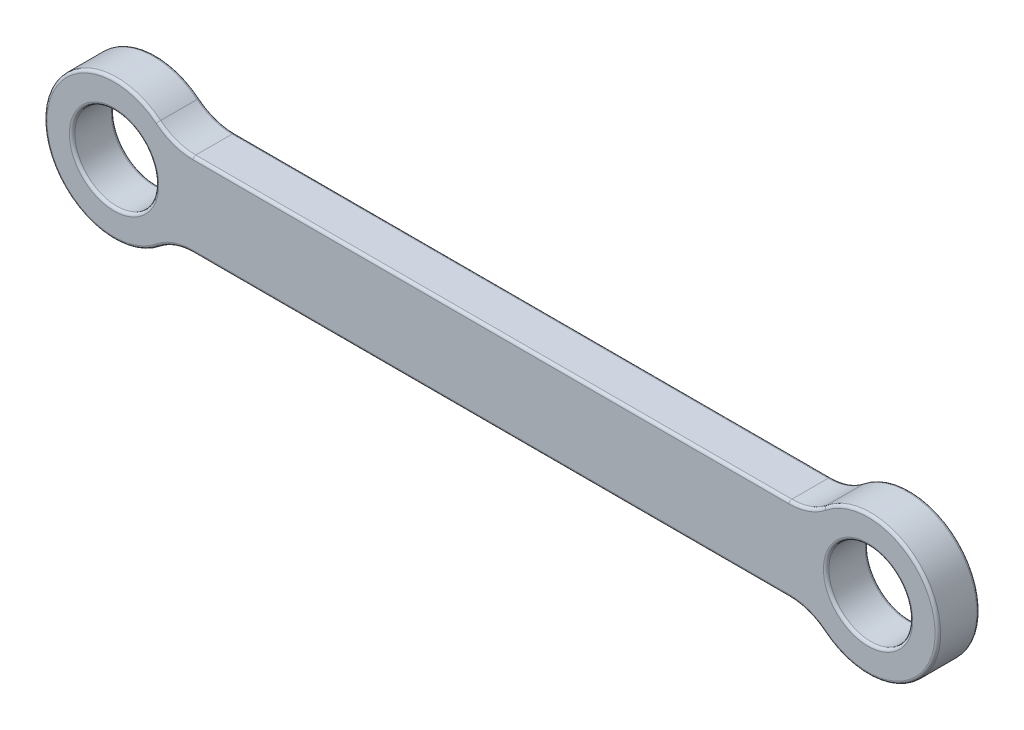
from build123d import *

# Parameters (mm, degrees)
SKETCH2_R           = 5
SKETCH2_R_2         = 3
BOSS_EXTRUDE1_DEPTH = 3
FILLET1_R           = 4
FILLET2_R           = 0.2


with BuildPart() as part:
    # Sketch2 → Boss-Extrude1 (new body)
    # profile 1 of 3: a face of its own
    with BuildSketch(Plane.XY):
        Circle(SKETCH2_R)
        Circle(SKETCH2_R_2, mode=Mode.SUBTRACT)
    # profile 2 of 3: a face of its own
    with BuildSketch(Plane.XY):
        with BuildLine():
            Line((4, -3), (50, -3))
            ThreePointArc((50, -3), (49, 0), (50, 3))
            Line((50, 3), (4, 3))
            ThreePointArc((4, 3), (4.74341649, 1.58113883), (5, 0))
            ThreePointArc((5, 0), (4.74341649, -1.58113883), (4, -3))
        make_face()
    # profile 3 of 3: a face of its own
    with BuildSketch(Plane.XY):
        with Locations((54, 0)):
            Circle(SKETCH2_R)
        with Locations((54, 0)):
            Circle(SKETCH2_R_2, mode=Mode.SUBTRACT)
    extrude(amount=BOSS_EXTRUDE1_DEPTH)

    # Fillet1
    fillet1_edges = [part.edges().sort_by_distance(p)[0] for p in [
        (4, 3, 1.5),
        (50, 3, 1.5),
        (50, -3, 1.5),
        (4, -3, 1.5),
    ]]
    fillet(fillet1_edges, radius=FILLET1_R)

    # Fillet2
    fillet2_edges = [part.edges().sort_by_distance(p)[0] for p in [
        (-3, 0, 0),
        (59, 0, 0),
        (59, 0, 3),
        (27, -3, 0),
        (27, -3, 3),
        (-5, 0, 0),
        (-5, 0, 3),
        (27, 3, 0),
        (27, 3, 3),
        (49.676479084, -3.228763834, 0),
        (49.676479084, -3.228763834, 3),
        (4.323520916, -3.228763834, 0),
        (4.323520916, -3.228763834, 3),
        (51, 0, 3),
        (49.676479084, 3.228763834, 0),
        (49.676479084, 3.228763834, 3),
        (4.323520916, 3.228763834, 0),
        (4.323520916, 3.228763834, 3),
        (-3, 0, 3),
        (51, 0, 0),
    ]]
    fillet(fillet2_edges, radius=FILLET2_R)


solid = part.part
